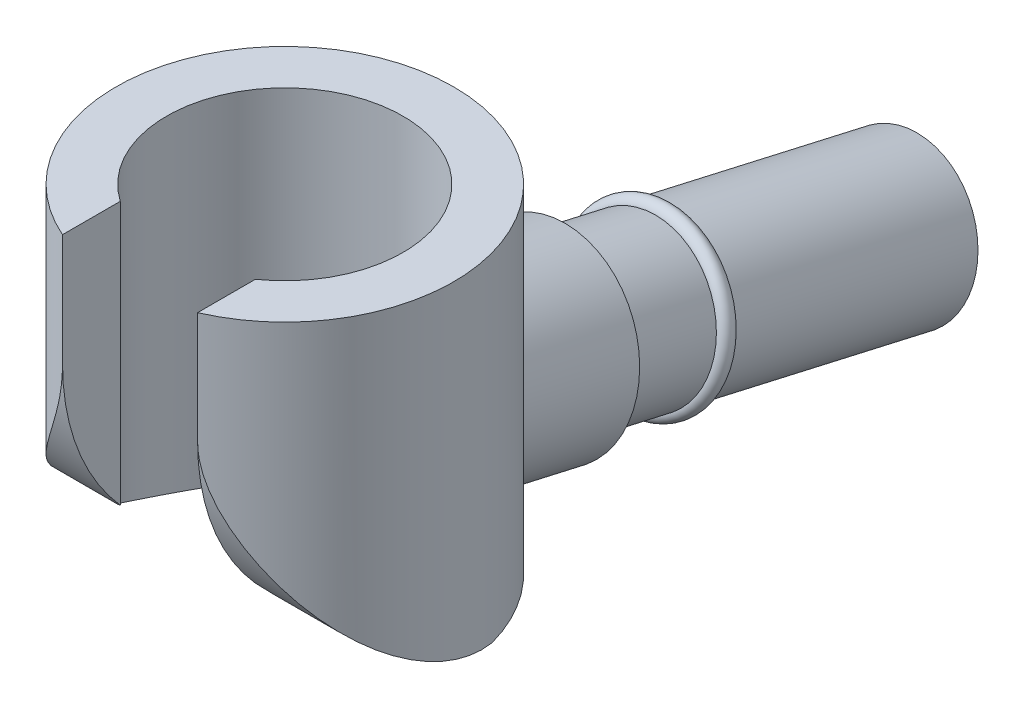
from build123d import *

# Parameters (mm, degrees)
BOSS_EXTRUDE1_DEPTH      = 2.5
CUT_EXTRUDE8_DEPTH       = 5.330127019
CUT_EXTRUDE8_DEPTH_BACK  = 5.330127019
BOSS_EXTRUDE2_REACH      = 14.744
BOSS_EXTRUDE2_END_RADIUS = 2.5
SKETCH6_R                = 1.125
BOSS_EXTRUDE4_REACH      = 20.144
BOSS_EXTRUDE4_START      = -5.4
SKETCH7_R                = 1.375
SKETCH5_R                = 0.125


with BuildPart() as part:
    # Sketch3 → Boss-Extrude1 (new, symmetric)
    with BuildSketch(Plane(origin=(0, 0, 0), x_dir=(1, 0, 0), z_dir=(0, 1, 0))):
        with BuildLine():
            Line((-1, -1.436140662), (-1, -2.291287847))
            ThreePointArc((-1, -2.291287847), (0, 2.5), (1, -2.291287847))
            Line((1, -2.291287847), (1, -1.436140662))
            ThreePointArc((1, -1.436140662), (0, 1.75), (-1, -1.436140662))
        make_face()
    extrude(amount=BOSS_EXTRUDE1_DEPTH, both=True)

    # Sketch4 → Cut-Extrude8 (cut, two sides: drawn at the far end of the back side and taken through both)
    with BuildSketch(Plane(origin=(0, 0, 0), x_dir=(0, 0, -1), z_dir=(1, 0, 0)).offset(-CUT_EXTRUDE8_DEPTH_BACK)):
        with BuildLine():
            ThreePointArc((-2.291287847, 0.85), (-1.448230481, -1.382297021), (0.66, -2.5))
            Line((0.66, -2.5), (-2.291287847, -2.5))
            Line((-2.291287847, -2.5), (-2.291287847, 0.85))
        make_face()
    extrude(amount=CUT_EXTRUDE8_DEPTH + CUT_EXTRUDE8_DEPTH_BACK, mode=Mode.SUBTRACT)

    # Boss-Extrude2: up to this cylinder (the profile starts outside it)
    boss_extrude2_end = Plane(origin=(0, -2.616609, 0), z_dir=(0, -1, 0)) * Cylinder(BOSS_EXTRUDE2_END_RADIUS, 35.488, mode=Mode.PRIVATE)
    # Sketch6 → Boss-Extrude2 (add, up to the surface)
    with BuildSketch(Plane(origin=(0, -2.616608772, -9.11), x_dir=(-1, 0, 0), z_dir=(0, -0.22222922625140035, -0.9749944466506996)), mode=Mode.PRIVATE) as boss_extrude2_sk1:
        with Locations(Location((0, 0, 0), (0, 0, 90))):
            Circle(SKETCH6_R)
    boss_extrude2_tool1 = extrude(boss_extrude2_sk1.sketch, amount=-BOSS_EXTRUDE2_REACH, mode=Mode.PRIVATE) - boss_extrude2_end
    add(boss_extrude2_tool1.solids().sort_by_distance((0, -2.616609, -9.11))[0])

    # Sketch7 → Boss-Extrude4 (add, up to next)
    with BuildSketch(Plane(origin=(0, -2.616608772, -9.11), x_dir=(-1, 0, 0), z_dir=(0, -0.22222922625140035, -0.9749944466506996)).offset(BOSS_EXTRUDE4_START), mode=Mode.PRIVATE) as boss_extrude4_sk1:
        with Locations(Location((0, 0, 0), (0, 0, 90))):
            Circle(SKETCH7_R)
    boss_extrude4_tool1 = extrude(boss_extrude4_sk1.sketch, amount=-BOSS_EXTRUDE4_REACH, mode=Mode.PRIVATE) - part.part
    add(boss_extrude4_tool1.solids().sort_by_distance((0, -1.416571, -3.84503))[0])

    # Sketch5 → Revolve1 (revolve)
    with BuildSketch(Plane(origin=(0, 0, 0), x_dir=(0, 0, -1), z_dir=(1, 0, 0)), mode=Mode.PRIVATE) as revolve1_sk:
        with Locations((5.11, -2.853618424)):
            Circle(SKETCH5_R)
    revolve(revolve1_sk.sketch.rotate(Axis((0, -1.11, -2.5), (0, -0.22222922625140032, -0.9749944466506997)), 180), axis=Axis((0, -1.11, -2.5), (0, -0.22222922625140032, -0.9749944466506997)))


solid = part.part
